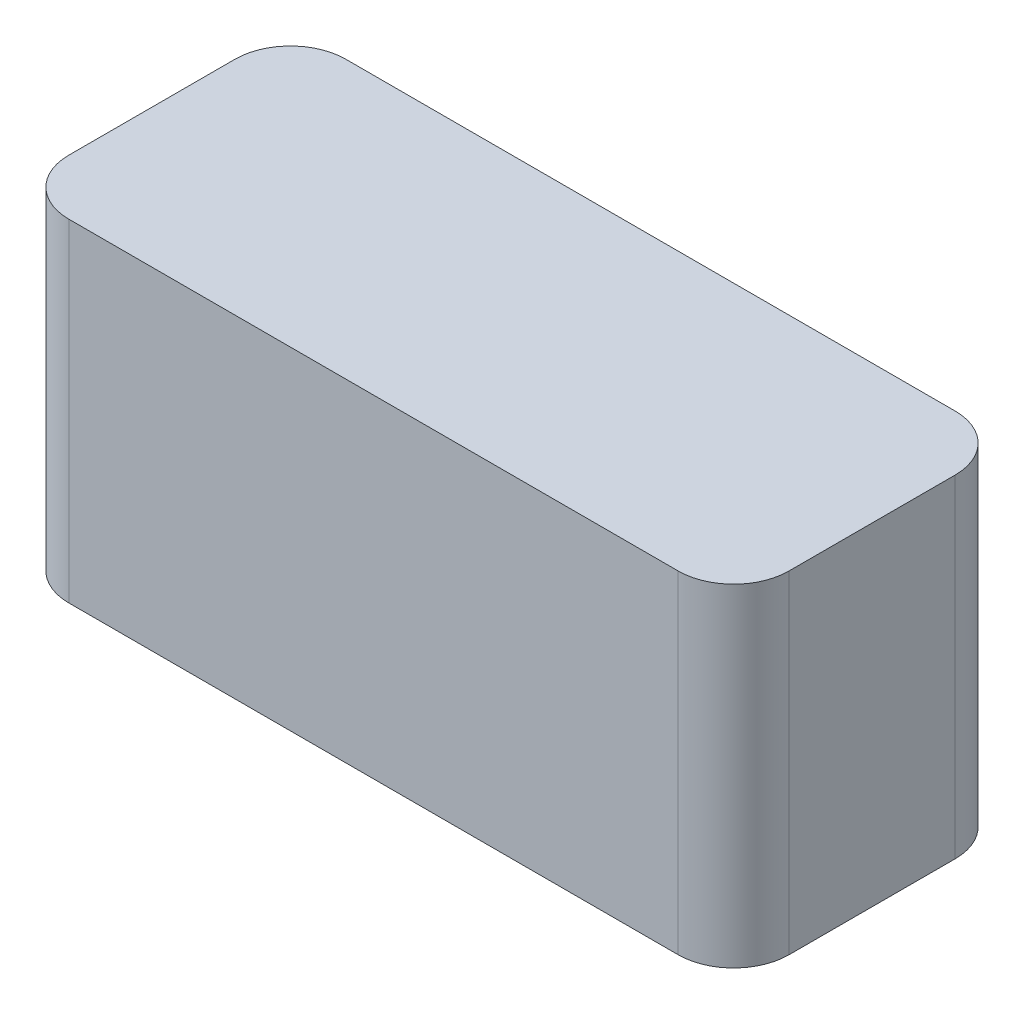
from build123d import *

# Parameters (mm, degrees)
SKETCH1_W           = 65
SKETCH1_H           = 25
BOSS_EXTRUDE1_DEPTH = 30
FILLET1_R           = 5


with BuildPart() as part:
    # Sketch1 → Boss-Extrude1 (new body)
    with BuildSketch(Plane(origin=(0, 0, 0), x_dir=(1, 0, 0), z_dir=(0, 1, 0))):
        Rectangle(SKETCH1_W, SKETCH1_H)
    extrude(amount=BOSS_EXTRUDE1_DEPTH)

    # Fillet1
    fillet1_edges = [part.edges().sort_by_distance(p)[0] for p in [
        (32.5, 15, 12.5),
        (-32.5, 15, 12.5),
        (-32.5, 15, -12.5),
        (32.5, 15, -12.5),
    ]]
    fillet(fillet1_edges, radius=FILLET1_R)


solid = part.part
